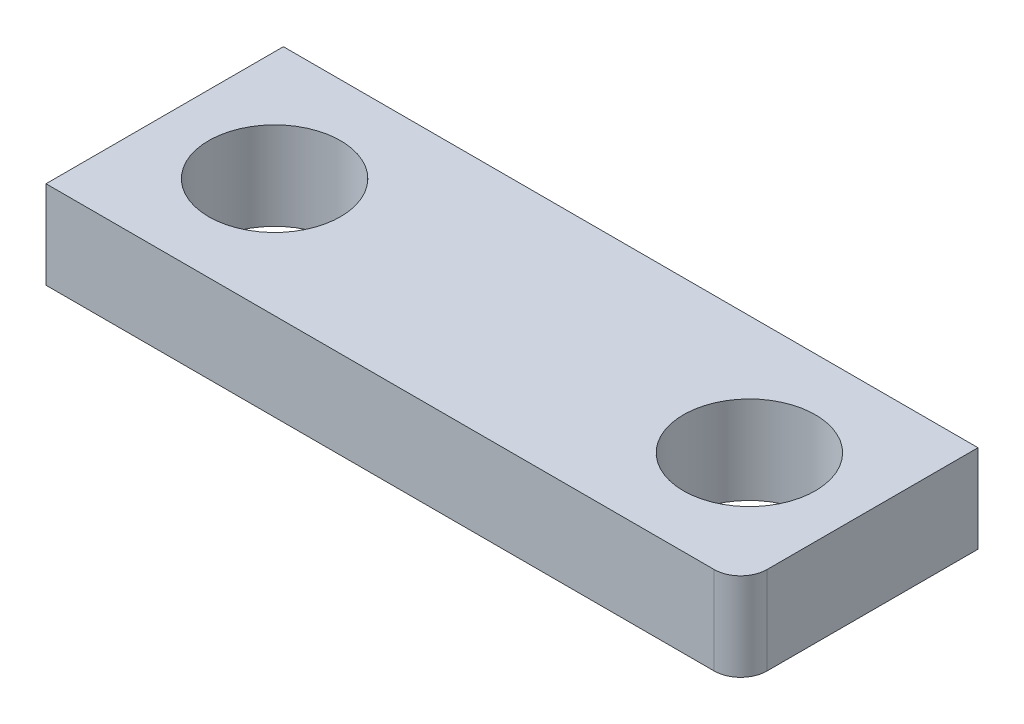
from build123d import *

# Parameters (mm, degrees)
SKETCH_1_W          = 79
SKETCH_1_H          = 27
EXTRUDE_1_DEPTH     = 10
SKETCH_3_R          = 7.5
CUT_EXTRUDE_1_DEPTH = 43.924352063
FILLET_1_R          = 3


with BuildPart() as part:
    # 草图1 → 凸台-拉伸1 (new body)
    with BuildSketch(Plane(origin=(0, 0, 0), x_dir=(1, 0, 0), z_dir=(0, 1, 0))):
        Rectangle(SKETCH_1_W, SKETCH_1_H)
    extrude(amount=EXTRUDE_1_DEPTH)

    # 草图3 → 切除-拉伸1 (cut, through all)
    with BuildSketch(Plane(origin=(0, 10, 0), x_dir=(1, 0, 0), z_dir=(0, 1, 0))):
        with Locations(Location((-27, 0, 0), (0, 0, 270))):
            Circle(SKETCH_3_R)
        with Locations(Location((27, 0, 0), (0, 0, 270))):
            Circle(SKETCH_3_R)
    extrude(amount=-CUT_EXTRUDE_1_DEPTH, mode=Mode.SUBTRACT)

    # 圆角1
    fillet_1_edges = [part.edges().sort_by_distance(p)[0] for p in [
        (39.5, 5, 13.5),
    ]]
    fillet(fillet_1_edges, radius=FILLET_1_R)


solid = part.part
